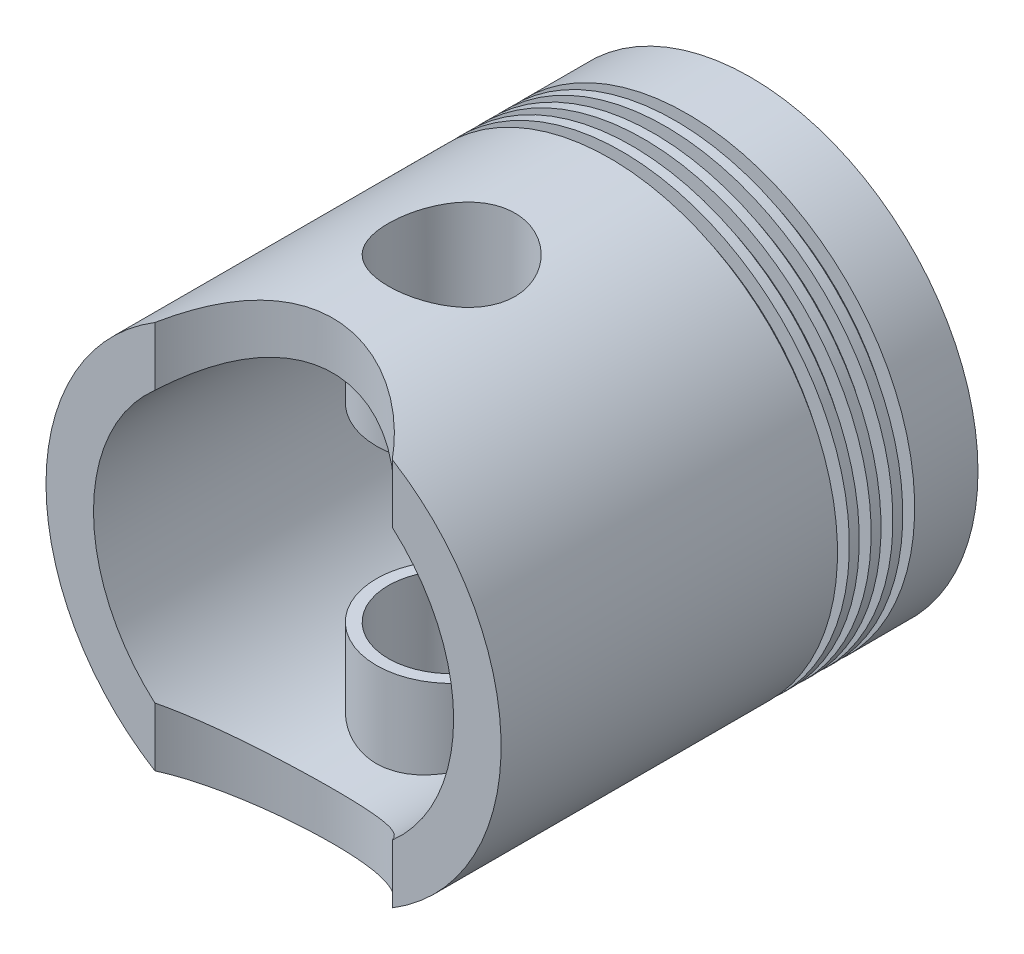
from build123d import *

# Parameters (mm, degrees)
CUT_EXTRUDE1_DEPTH       = 156.00175185
CUT_EXTRUDE1_DEPTH_BACK  = 156.00175185
SKETCH2_R                = 16
BOSS_EXTRUDE1_REACH      = 167.413
BOSS_EXTRUDE1_END_RADIUS = 45.5
SKETCH4_R                = 19
SKETCH4_R_2              = 16
CUT_EXTRUDE2_DEPTH       = 156.001751924
CUT_EXTRUDE2_DEPTH_BACK  = 156.001751924


with BuildPart() as part:
    # Sketch1 → Revolve1 (revolve)
    with BuildSketch(Plane(origin=(0, 0, 0), x_dir=(1, 0, 0), z_dir=(0, 1, 0)), mode=Mode.PRIVATE) as revolve1_sk:
        with BuildLine():
            Line((0, 131.958489975), (0, 116.958489975))
            ThreePointArc((0, 116.958489975), (23.090251563, 114.969167301), (45.5, 109.059827497))
            Line((45.5, 109.059827497), (45.5, 0))
            Line((45.5, 0), (57.5, 0))
            Line((57.5, 0), (57.5, 85))
            Line((57.5, 85), (53.5, 85))
            Line((53.5, 85), (53.5, 88))
            Line((53.5, 88), (57.5, 88))
            Line((57.5, 88), (57.5, 90.5))
            Line((57.5, 90.5), (53.5, 90.5))
            Line((53.5, 90.5), (53.5, 93.5))
            Line((53.5, 93.5), (57.5, 93.5))
            Line((57.5, 93.5), (57.5, 96))
            Line((57.5, 96), (53.5, 96))
            Line((53.5, 96), (53.5, 99))
            Line((53.5, 99), (57.5, 99))
            Line((57.5, 99), (57.5, 101.5))
            Line((57.5, 101.5), (53.5, 101.5))
            Line((53.5, 101.5), (53.5, 104.5))
            Line((53.5, 104.5), (57.5, 104.5))
            Line((57.5, 104.5), (57.5, 120.5))
            ThreePointArc((57.5, 120.5), (29.315298875, 129.065978744), (0, 131.958489975))
        make_face()
    revolve(revolve1_sk.sketch.rotate(Axis((0, 0, -138.64598988), (0, 0, 1)), 180), axis=Axis((0, 0, -138.64598988), (0, 0, 1)))

    # Sketch2 → Cut-Extrude1 (cut, two sides: drawn at the far end of the back side and taken through both)
    with BuildSketch(Plane(origin=(0, 0, 0), x_dir=(1, 0, 0), z_dir=(0, 1, 0)).offset(-CUT_EXTRUDE1_DEPTH_BACK)):
        with Locations(Location((0, 45, 0), (0, 0, 270))):
            Circle(SKETCH2_R)
    extrude(amount=CUT_EXTRUDE1_DEPTH + CUT_EXTRUDE1_DEPTH_BACK, mode=Mode.SUBTRACT)

    # Boss-Extrude1: up to this cylinder (the profile starts inside it)
    boss_extrude1_end = Plane(origin=(0, 0, -26.537401), z_dir=(0, 0, -1)) * Cylinder(BOSS_EXTRUDE1_END_RADIUS, 426.826, mode=Mode.PRIVATE)
    # Sketch4 → Boss-Extrude1 (add, up to the surface)
    with BuildSketch(Plane(origin=(0, 24, 0), x_dir=(1, 0, 0), z_dir=(0, 1, 0)), mode=Mode.PRIVATE) as boss_extrude1_sk1:
        with Locations(Location((0, 45, 0), (0, 0, 90))):
            Circle(SKETCH4_R)
        with Locations(Location((0, 45, 0), (0, 0, 270))):
            Circle(SKETCH4_R_2, mode=Mode.SUBTRACT)
    boss_extrude1_tool1 = extrude(boss_extrude1_sk1.sketch, amount=BOSS_EXTRUDE1_REACH, mode=Mode.PRIVATE) & boss_extrude1_end
    boss_extrude1 = boss_extrude1_tool1.solids().sort_by_distance((0, 24, -26.537401))[0]
    add(boss_extrude1)

    # Mirror1: Boss-Extrude1 across plane
    add(boss_extrude1.mirror(Plane.ZX))

    # Sketch5 → Cut-Extrude2 (cut, two sides: drawn at the far end of the back side and taken through both)
    with BuildSketch(Plane(origin=(0, 0, 0), x_dir=(1, 0, 0), z_dir=(0, 1, 0)).offset(-CUT_EXTRUDE2_DEPTH_BACK)):
        with BuildLine():
            Line((-30, 0), (30, 0))
            ThreePointArc((30, 0), (0, 15), (-30, 0))
        make_face()
    extrude(amount=CUT_EXTRUDE2_DEPTH + CUT_EXTRUDE2_DEPTH_BACK, mode=Mode.SUBTRACT)


solid = part.part
